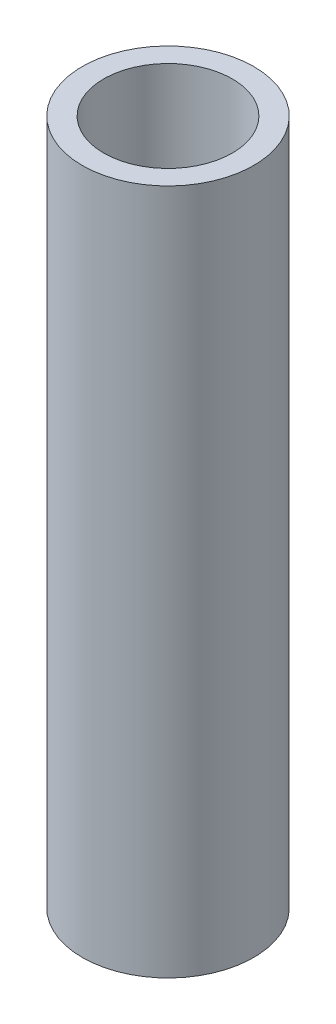
from build123d import *

# Parameters (mm, degrees)
SKETCH_1_R      = 1
SKETCH_1_R_2    = 0.75
EXTRUDE_1_DEPTH = 8


with BuildPart() as part:
    # 草图1 → 凸台-拉伸1 (new body)
    with BuildSketch(Plane(origin=(0, 0, 0), x_dir=(1, 0, 0), z_dir=(0, 1, 0))):
        with Locations(Location((0, 0, 0), (0, 0, 270))):
            Circle(SKETCH_1_R)
        with Locations(Location((0, 0, 0), (0, 0, 270))):
            Circle(SKETCH_1_R_2, mode=Mode.SUBTRACT)
    extrude(amount=EXTRUDE_1_DEPTH)


solid = part.part
